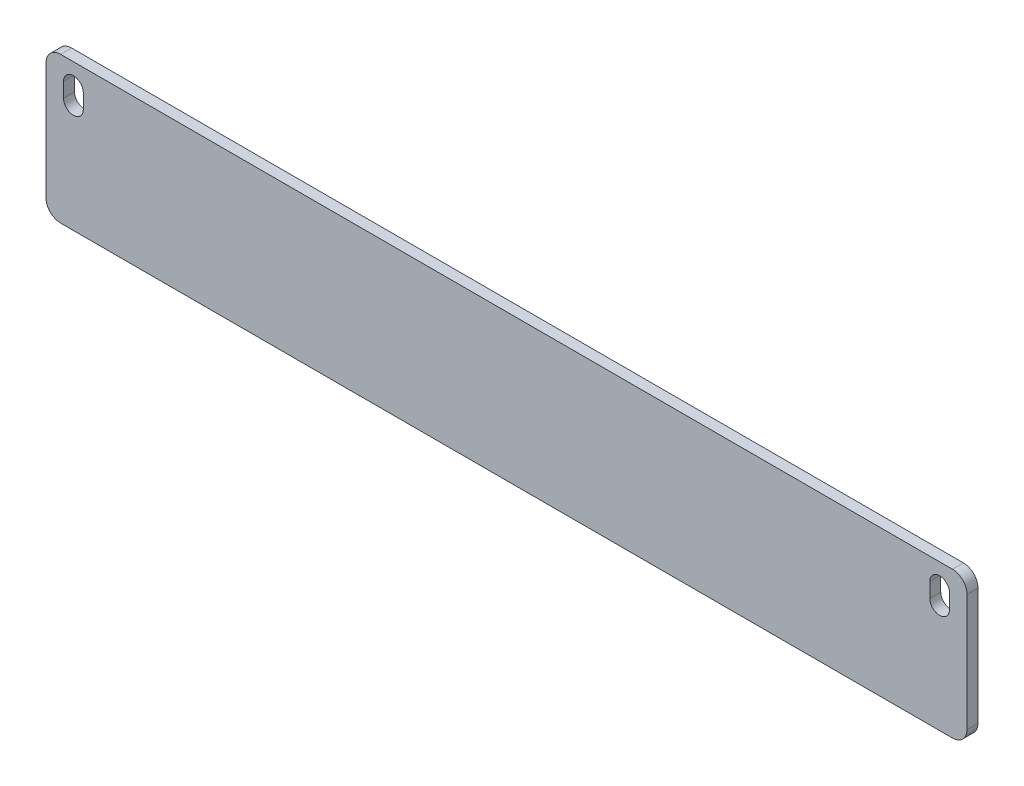
from build123d import *

# Parameters (mm, degrees)
SKETCH1_W           = 252
SKETCH1_H           = 40
BOSS_EXTRUDE1_DEPTH = 3
FILLET1_R           = 4


with BuildPart() as part:
    # Sketch1 → Boss-Extrude1 (new body)
    with BuildSketch(Plane.XY):
        with Locations((126, 20)):
            Rectangle(SKETCH1_W, SKETCH1_H)
        with BuildLine():
            Line((10.2, 34), (10.2, 30))
            ThreePointArc((10.2, 30), (7.5, 27.3), (4.8, 30))
            Line((4.8, 30), (4.8, 34))
            ThreePointArc((4.8, 34), (7.5, 36.7), (10.2, 34))
        make_face(mode=Mode.SUBTRACT)
        with BuildLine():
            Line((247.2, 34), (247.2, 30))
            ThreePointArc((247.2, 30), (244.5, 27.3), (241.8, 30))
            Line((241.8, 30), (241.8, 34))
            ThreePointArc((241.8, 34), (244.5, 36.7), (247.2, 34))
        make_face(mode=Mode.SUBTRACT)
    extrude(amount=BOSS_EXTRUDE1_DEPTH)

    # Fillet1
    fillet1_edges = [part.edges().sort_by_distance(p)[0] for p in [
        (0, 40, 1.5),
        (252, 40, 1.5),
        (252, 0, 1.5),
        (0, 0, 1.5),
    ]]
    fillet(fillet1_edges, radius=FILLET1_R)


solid = part.part
